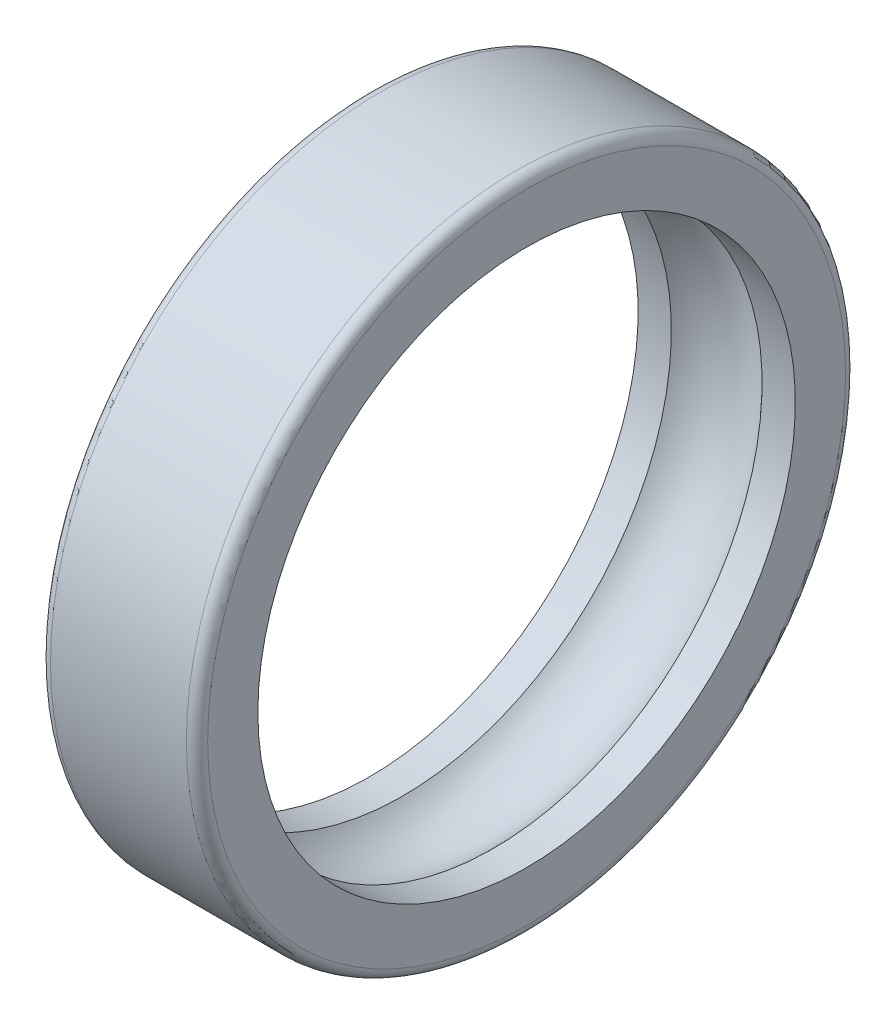
from build123d import *

# Parameters (mm, degrees)
FILLET1_R    = 2.1
SCALE1_SCALE = 1.413611111


with BuildPart() as part:
    # Sketch1 → Revolve1 (revolve)
    with BuildSketch(Plane.XY, mode=Mode.PRIVATE) as revolve1_sk:
        with BuildLine():
            Line((-15.5, 65), (15.5, 65))
            Line((15.5, 65), (15.5, 53))
            Line((15.5, 53), (8.94427191, 53))
            ThreePointArc((8.94427191, 53), (0, 57), (-8.94427191, 53))
            Line((-8.94427191, 53), (-15.5, 53))
            Line((-15.5, 53), (-15.5, 65))
        make_face()
    revolve(revolve1_sk.sketch.rotate(Axis((-25.358454362, 0, 0), (1, 0, 0)), 90), axis=Axis((-25.358454362, 0, 0), (1, 0, 0)))

    # Fillet1
    fillet1_edges = [part.edges().sort_by_distance(p)[0] for p in [
        (15.5, 0, -65),
        (-15.5, 0, -65),
    ]]
    fillet(fillet1_edges, radius=FILLET1_R)


with BuildPart() as part_1:
    # Scale1: scaled about (0, 0, 0)
    add(part.part.scale(SCALE1_SCALE))


solid = part_1.part
